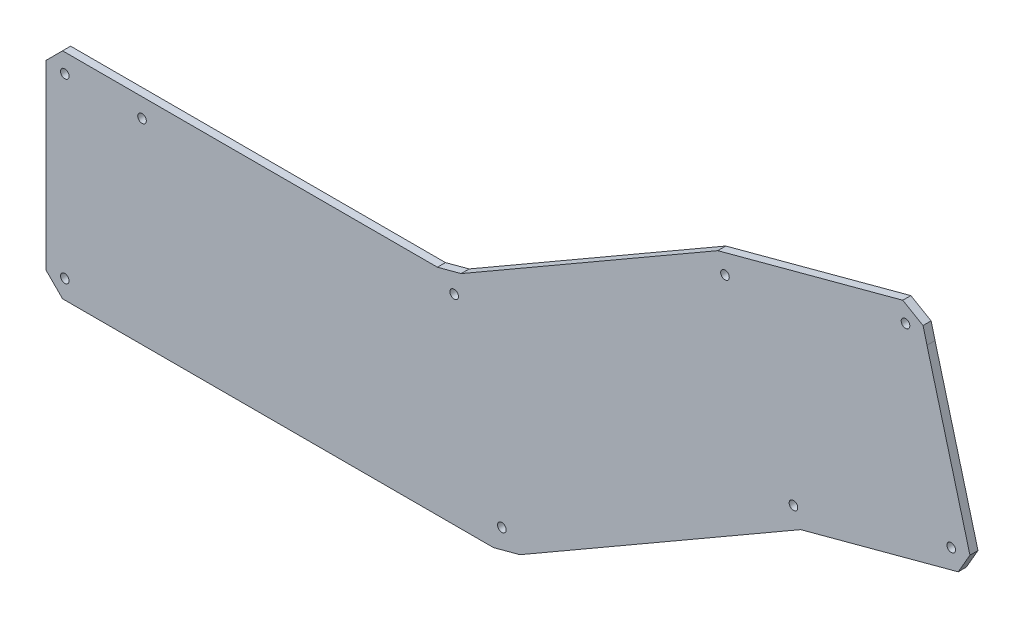
from build123d import *

# Parameters (mm, degrees)
ESQUISSE1_R        = 1.6
BOSS_EXTRU_1_DEPTH = 3


with BuildPart() as part:
    # Esquisse1 → Boss.-Extru.1 (new body)
    with BuildSketch(Plane.XY):
        Polygon((-76.753762562, 51.085106383), (-96.582189687, 51.085106383), (-102.753762562, 44.913533508), (-102.753762562, 35.79522772), (-102.753762562, -22.743320742), (-96.582189687, -28.914893617), (63.932030858, -28.914893617), (73.770824067, -26.278596922), (178.322766002, 34.084494899), (237.005572372, 49.808505475), (241.369533403, 57.367107702), (230.025901746, 99.702117388), (225.368652661, 117.083207596), (223.893223799, 122.719498558), (216.359063387, 127.098384499), (210.670220477, 125.574063635), (147.443918593, 108.632627105), (51.862743071, 53.448809688), (43.041282242, 51.085106383), (-75.988646329, 51.085106383), align=None)
        with Locations((-95.753762562, 44.085106383)):
            Circle(ESQUISSE1_R, mode=Mode.SUBTRACT)
        with Locations((-66.988646329, 44.085106383)):
            Circle(ESQUISSE1_R, mode=Mode.SUBTRACT)
        with Locations((-95.753762562, -21.914893617)):
            Circle(ESQUISSE1_R, mode=Mode.SUBTRACT)
        with Locations((49.263745973, 45.505477252)):
            Circle(ESQUISSE1_R, mode=Mode.SUBTRACT)
        with Locations((67.039694146, -20.835264486)):
            Circle(ESQUISSE1_R, mode=Mode.SUBTRACT)
        with Locations((217.363403759, 120.120565138)):
            Circle(ESQUISSE1_R, mode=Mode.SUBTRACT)
        with Locations((150.12930694, 102.149526137)):
            Circle(ESQUISSE1_R, mode=Mode.SUBTRACT)
        with Locations((175.637377655, 40.567595866)):
            Circle(ESQUISSE1_R, mode=Mode.SUBTRACT)
        with Locations((234.393639901, 56.355573542)):
            Circle(ESQUISSE1_R, mode=Mode.SUBTRACT)
    extrude(amount=BOSS_EXTRU_1_DEPTH)


solid = part.part
